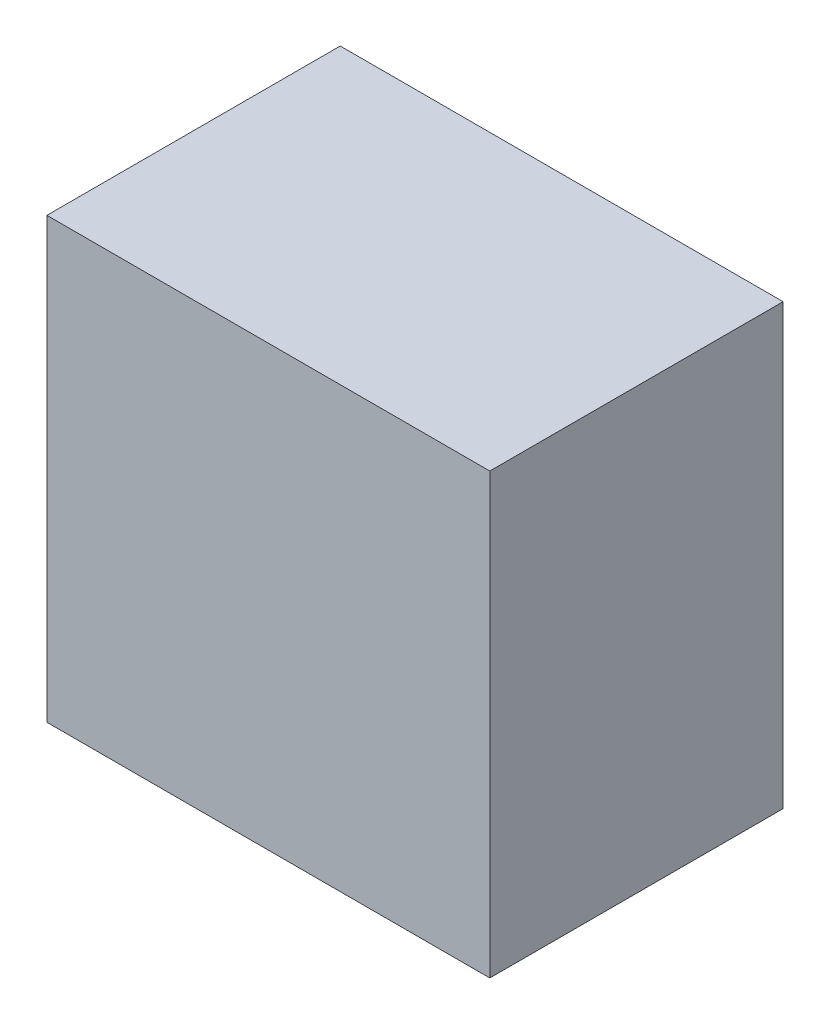
from build123d import *

# Parameters (mm, degrees)
SKETCH1_W               = 1.51
SKETCH1_H               = 1.497
COMPONENT_OUTLINE_DEPTH = 1


with BuildPart() as part:
    # Sketch1 → Component_Outline (new body)
    with BuildSketch(Plane.XY):
        with Locations((-0.005, 0.0515)):
            Rectangle(SKETCH1_W, SKETCH1_H)
    extrude(amount=COMPONENT_OUTLINE_DEPTH)


solid = part.part
